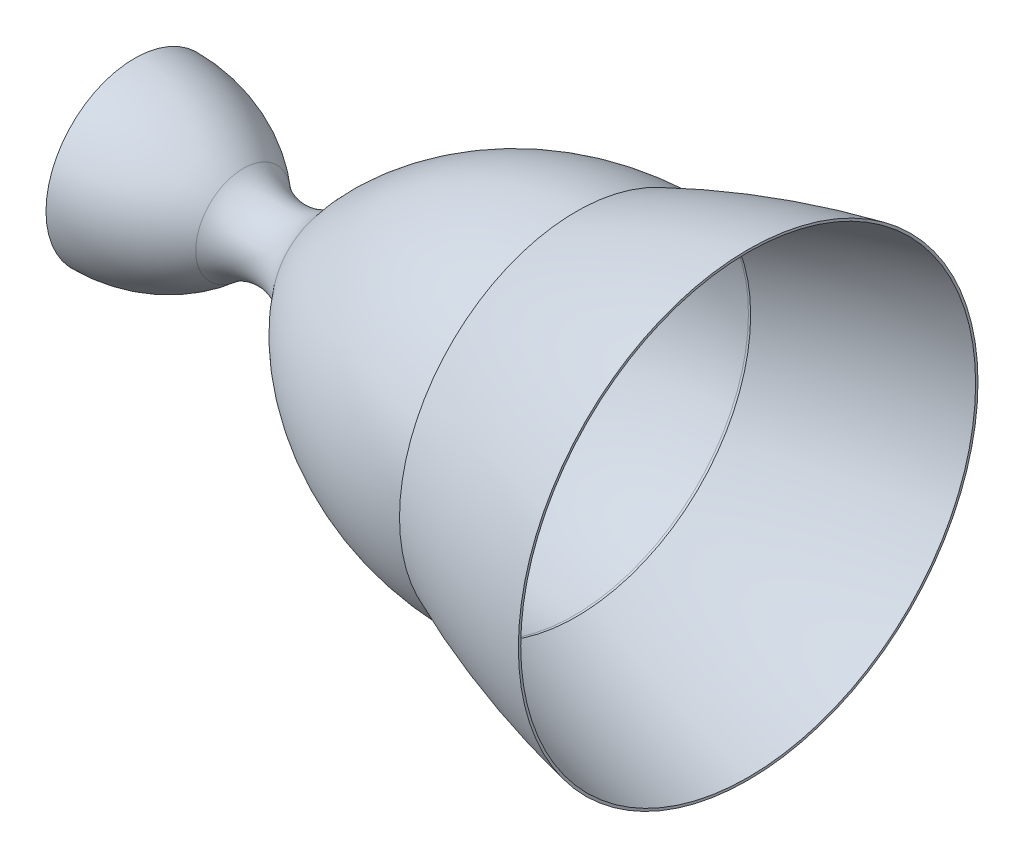
from build123d import *


with BuildPart() as part:
    # Croquis1 → Revolución4 (revolve)
    with BuildSketch(Plane.XY, mode=Mode.PRIVATE) as revoluci_n4_sk:
        with BuildLine():
            Line((199, 78.918522676), (200, 78.918522676))
            ThreePointArc((200, 78.918522676), (238.285228956, 92.913252463), (277.795971192, 102.938843023))
            Line((277.795971192, 102.938843023), (277.795971192, 104.020320348))
            ThreePointArc((277.795971192, 104.020320348), (238.285228956, 93.994729787), (200, 80))
            ThreePointArc((200, 80), (137.453289795, 65.562899543), (87.561875557, 25.172707511))
            ThreePointArc((87.561875557, 25.172707511), (69.213976897, 15.119616963), (49.296496377, 21.523052333))
            ThreePointArc((49.296496377, 21.523052333), (26.322719037, 35.229014392), (0, 40))
            Line((0, 40), (0, 38.915288903))
            Line((0, 38.915288903), (1, 38.915288903))
            ThreePointArc((1, 38.915288903), (26.412003084, 34.042566774), (48.5879763, 20.710667675))
            ThreePointArc((48.5879763, 20.710667675), (69.316324283, 14.046539825), (88.411190614, 24.508905232))
            ThreePointArc((88.411190614, 24.508905232), (137.4767114, 64.374064962), (199, 78.918522676))
        make_face()
    revolve(revoluci_n4_sk.sketch.rotate(Axis((0, 0, 0), (1, 0, 0)), 90), axis=Axis((0, 0, 0), (1, 0, 0)))


solid = part.part
